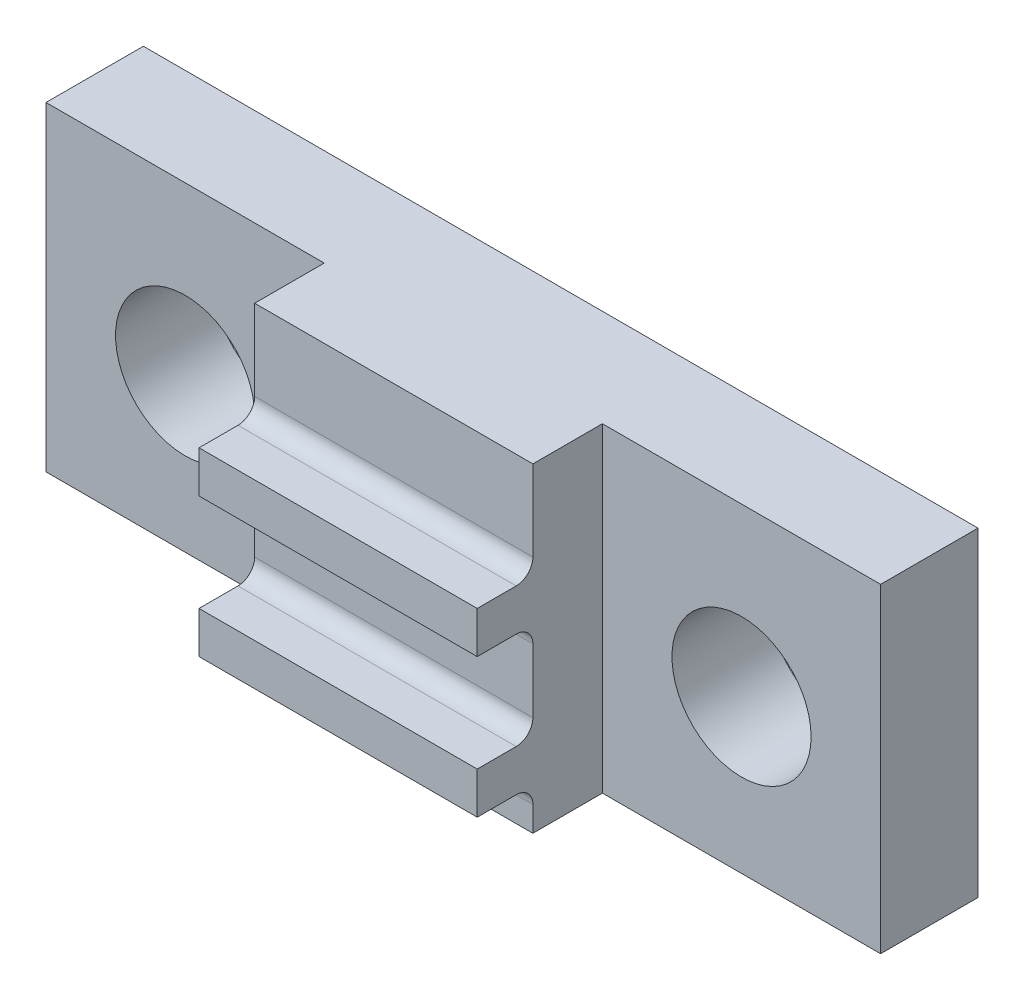
from build123d import *

# Parameters (mm, degrees)
SKETCH1_W           = 30
SKETCH1_H           = 11.5
SKETCH1_R           = 2.5
BOSS_EXTRUDE1_DEPTH = 3.5
SKETCH2_W           = 10
SKETCH2_H           = 11.5
BOSS_EXTRUDE2_DEPTH = 4.5
SKETCH3_W           = 2
SKETCH3_H           = 3.5
CUT_EXTRUDE1_DEPTH  = 23.29489852
SKETCH4_W           = 2
SKETCH4_H           = 3.5
CUT_EXTRUDE2_DEPTH  = 10
FILLET2_R           = 0.6


with BuildPart() as part:
    # Sketch1 → Boss-Extrude1 (new body)
    with BuildSketch(Plane.XY):
        Rectangle(SKETCH1_W, SKETCH1_H)
        with Locations((-10, -0.25)):
            Circle(SKETCH1_R, mode=Mode.SUBTRACT)
        with Locations((10, -0.25)):
            Circle(SKETCH1_R, mode=Mode.SUBTRACT)
    extrude(amount=BOSS_EXTRUDE1_DEPTH)

    # Sketch2 → Boss-Extrude2 (add)
    with BuildSketch(Plane.XY.offset(3.5)):
        Rectangle(SKETCH2_W, SKETCH2_H)
    extrude(amount=BOSS_EXTRUDE2_DEPTH)

    # Sketch3 → Cut-Extrude1 (cut, through all)
    with BuildSketch(Plane.ZY.offset(5)):
        with Locations((7, 4)):
            Rectangle(SKETCH3_W, SKETCH3_H)
    extrude(amount=-CUT_EXTRUDE1_DEPTH, mode=Mode.SUBTRACT)

    # Sketch4 → Cut-Extrude2 (cut)
    with BuildSketch(Plane.ZY.offset(5)):
        with Locations((7, -1)):
            Rectangle(SKETCH4_W, SKETCH4_H)
        with Locations((7, -6)):
            Rectangle(SKETCH4_W, SKETCH4_H)
    extrude(amount=-CUT_EXTRUDE2_DEPTH, mode=Mode.SUBTRACT)

    # Fillet2
    fillet2_edges = [part.edges().sort_by_distance(p)[0] for p in [
        (0, 2.25, 6),
        (0, -2.75, 6),
        (0, 0.75, 6),
        (0, -4.25, 6),
    ]]
    fillet(fillet2_edges, radius=FILLET2_R)


solid = part.part
